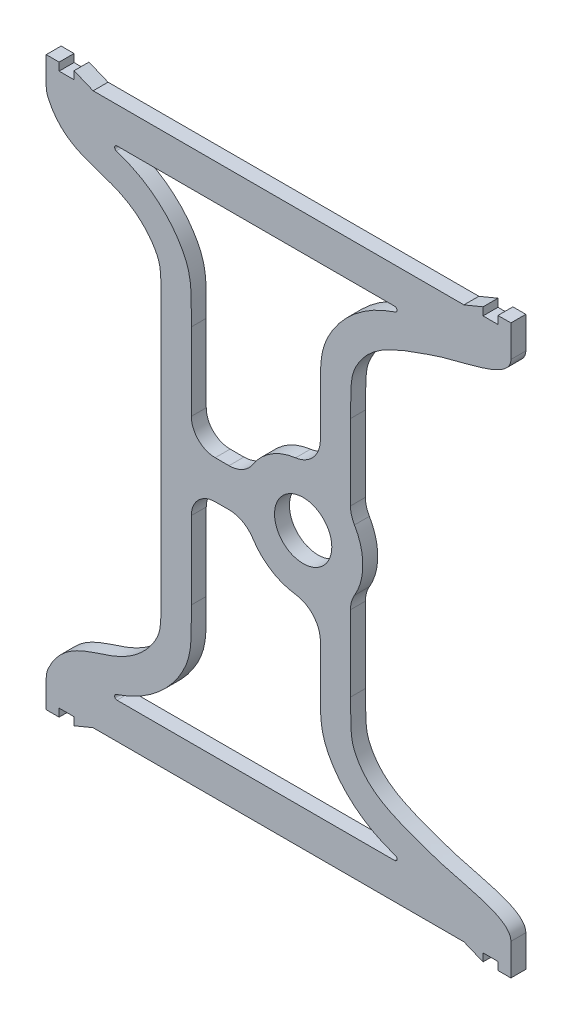
from build123d import *

# Parameters (mm, degrees)
SKETCH1_R           = 3.048
BOSS_EXTRUDE2_DEPTH = 1.5875
FILLET1_R           = 0.254
FILLET2_R           = 2.54


with BuildPart() as part:
    # Sketch1 → Boss-Extrude2 (new body)
    with BuildSketch(Plane.XY):
        with BuildLine():
            Line((-63.445118236, 56.995272298), (-61.413118236, 56.1594))
            Line((-61.413118236, 56.1594), (-21.954933142, 56.1594))
            Line((-21.954933142, 56.1594), (-19.922933142, 56.995272298))
            Line((-19.922933142, 56.995272298), (-19.922933142, 56.1594))
            Line((-19.922933142, 56.1594), (-18.335433142, 56.1594))
            Line((-18.335433142, 56.1594), (-18.335433142, 56.995272298))
            Line((-18.335433142, 56.995272298), (-16.959467842, 56.995272298))
            Line((-16.959467842, 56.995272298), (-16.959467842, 53.6194))
            add(Edge.make_bspline(
                [(-16.959467842, 53.6194), (-16.958675299, 51.706853552), (-22.34771901, 50.873251668), (-27.970226959, 48.915271091), (-28.3324007, 48.778613338), (-32.040022312, 47.058809649), (-34.043884909, 44.084161427), (-33.977658838, 42.841164425), (-34.028382429, 39.645281186)],
                knots=[0, 0, 0, 0, 0.161069097, 0.19942284, 0.363080258, 0.414817965, 0.696342734, 1, 1, 1, 1], degree=3))
            Line((-34.028382429, 39.645281186), (-34.028382429, 31.59256633))
            ThreePointArc((-34.028382429, 31.59256633), (-33.920729589, 30.793871006), (-33.6054545, 30.052180389))
            ThreePointArc((-33.6054545, 30.052180389), (-32.7152, 26.8097), (-33.6054545, 23.567219611))
            ThreePointArc((-33.6054545, 23.567219611), (-33.920729589, 22.825528994), (-34.028382429, 22.02683367))
            Line((-34.028382429, 22.02683367), (-34.028382429, 13.974118814))
            add(Edge.make_bspline(
                [(-16.959467842, 0), (-16.958675299, 1.912546448), (-22.34771901, 2.746148332), (-27.970226959, 4.704128909), (-28.3324007, 4.840786662), (-32.040022312, 6.560590351), (-34.043884909, 9.535238573), (-33.977658838, 10.778235575), (-34.028382429, 13.974118814)],
                knots=[0, 0, 0, 0, 0.161069097, 0.19942284, 0.363080258, 0.414817965, 0.696342734, 1, 1, 1, 1], degree=3))
            Line((-16.959467842, 0), (-16.959467842, -3.375872298))
            Line((-16.959467842, -3.375872298), (-18.335433142, -3.375872298))
            Line((-18.335433142, -3.375872298), (-18.335433142, -2.54))
            Line((-18.335433142, -2.54), (-19.922933142, -2.54))
            Line((-19.922933142, -2.54), (-19.922933142, -3.375872298))
            Line((-19.922933142, -3.375872298), (-21.954933142, -2.54))
            Line((-21.954933142, -2.54), (-61.413118236, -2.54))
            Line((-61.413118236, -2.54), (-63.445118236, -3.375872298))
            Line((-63.445118236, -3.375872298), (-63.445118236, -2.54))
            Line((-63.445118236, -2.54), (-65.032618236, -2.54))
            Line((-65.032618236, -2.54), (-65.032618236, -3.375872298))
            Line((-65.032618236, -3.375872298), (-66.408583535, -3.375872298))
            Line((-66.408583535, -3.375872298), (-66.408583535, 0))
            add(Edge.make_bspline(
                [(-66.408583535, 0), (-64.924134504, 3.970970778), (-61.093412842, 4.200703757), (-56.357340235, 6.517802076), (-54.056381444, 9.552241713), (-54.218088214, 10.785685691), (-54.167482869, 13.974118814)],
                knots=[0, 0, 0, 0, 0.36456502, 0.416182118, 0.697050608, 1, 1, 1, 1], degree=3))
            Line((-54.167482869, 13.974118814), (-54.167482869, 39.645281186))
            add(Edge.make_bspline(
                [(-66.408583535, 53.6194), (-64.924134504, 49.648429222), (-61.093412842, 49.418696243), (-56.357340235, 47.101597924), (-54.056381444, 44.067158287), (-54.218088214, 42.833714309), (-54.167482869, 39.645281186)],
                knots=[0, 0, 0, 0, 0.36456502, 0.416182118, 0.697050608, 1, 1, 1, 1], degree=3))
            Line((-66.408583535, 53.6194), (-66.408583535, 56.995272298))
            Line((-66.408583535, 56.995272298), (-65.032618236, 56.995272298))
            Line((-65.032618236, 56.995272298), (-65.032618236, 56.1594))
            Line((-65.032618236, 56.1594), (-63.445118236, 56.1594))
            Line((-63.445118236, 56.1594), (-63.445118236, 56.995272298))
        make_face()
        with Locations((-39.0652, 26.8097)):
            Circle(SKETCH1_R, mode=Mode.SUBTRACT)
        with BuildLine():
            Line((-60.420212319, 1.27), (-27.775652978, 1.27))
            add(Edge.make_bspline(
                [(-27.775652978, 1.27), (-27.937911803, 1.32747018), (-28.25192712, 1.434141719), (-28.977709802, 1.674229834), (-29.985010449, 2.012002863), (-31.331272347, 2.602546577), (-32.501735131, 3.28929043), (-33.532725298, 4.048582933), (-34.708077518, 5.120067508), (-35.601932415, 6.225598517), (-36.251519703, 7.294831691), (-36.629031327, 8.051039086), (-36.957652822, 8.969633494), (-37.136118728, 9.912816354), (-37.202804657, 10.779703127), (-37.222481171, 11.653006435), (-37.224921762, 12.504225188), (-37.227129046, 13.297769798), (-37.22983639, 13.76903369), (-37.231674963, 13.995349312)],
                knots=[0.254793571, 0.254793571, 0.254793571, 0.254793571, 0.278081272, 0.301368973, 0.347944374, 0.394519776, 0.441095178, 0.48767058, 0.534245982, 0.627396785, 0.673972187, 0.720547589, 0.767122991, 0.813698393, 0.860273795, 0.906849196, 0.953424598, 0.976712299, 1, 1, 1, 1], degree=3))
            Line((-37.231674963, 13.995349312), (-37.231674963, 17.518066134))
            ThreePointArc((-37.231674963, 17.518066134), (-37.984519135, 19.511899309), (-39.867288431, 20.510560841))
            ThreePointArc((-39.867288431, 20.510560841), (-42.460247999, 21.443495654), (-44.413829101, 23.387030466))
            ThreePointArc((-44.413829101, 23.387030466), (-45.506465964, 24.407291846), (-46.954770627, 24.7777))
            Line((-46.954770627, 24.7777), (-48.424190334, 24.7777))
            ThreePointArc((-48.424190334, 24.7777), (-50.220241558, 24.033751224), (-50.964190334, 22.2377))
            Line((-50.964190334, 22.2377), (-50.964190334, 13.995349312))
            add(Edge.make_bspline(
                [(-50.964190334, 13.995349312), (-50.966028907, 13.76903369), (-50.968736252, 13.297769798), (-50.970943536, 12.504225188), (-50.973384126, 11.653006435), (-50.99306064, 10.779703127), (-51.059746569, 9.912816354), (-51.238212475, 8.969633494), (-51.56683397, 8.051039086), (-51.944345594, 7.294831691), (-52.593932882, 6.225598517), (-53.487787779, 5.120067508), (-54.663139999, 4.048582933), (-55.694130166, 3.28929043), (-56.86459295, 2.602546577), (-58.210854848, 2.012002863), (-59.218155496, 1.674229834), (-59.943938178, 1.434141719), (-60.257953494, 1.32747018), (-60.420212319, 1.27)],
                knots=[0.254793571, 0.254793571, 0.254793571, 0.254793571, 0.278081272, 0.301368973, 0.347944374, 0.394519776, 0.441095178, 0.48767058, 0.534245982, 0.580821384, 0.627396785, 0.720547589, 0.767122991, 0.813698393, 0.860273795, 0.906849196, 0.953424598, 0.976712299, 1, 1, 1, 1], degree=3))
        make_face(mode=Mode.SUBTRACT)
        with BuildLine():
            Line((-60.420212319, 52.3494), (-27.775652978, 52.3494))
            add(Edge.make_bspline(
                [(-27.775652978, 52.3494), (-27.937911803, 52.29192982), (-28.25192712, 52.185258281), (-28.977709802, 51.945170166), (-29.985010449, 51.607397137), (-31.331272347, 51.016853423), (-32.501735131, 50.33010957), (-33.532725298, 49.570817067), (-34.708077518, 48.499332492), (-35.601932415, 47.393801483), (-36.251519703, 46.324568309), (-36.629031327, 45.568360914), (-36.957652822, 44.649766506), (-37.136118728, 43.706583646), (-37.202804657, 42.839696873), (-37.222481171, 41.966393565), (-37.224921762, 41.115174812), (-37.227129046, 40.321630202), (-37.22983639, 39.85036631), (-37.231674963, 39.624050688)],
                knots=[0.254793571, 0.254793571, 0.254793571, 0.254793571, 0.278081272, 0.301368973, 0.347944374, 0.394519776, 0.441095178, 0.48767058, 0.534245982, 0.627396785, 0.673972187, 0.720547589, 0.767122991, 0.813698393, 0.860273795, 0.906849196, 0.953424598, 0.976712299, 1, 1, 1, 1], degree=3))
            Line((-37.231674963, 39.624050688), (-37.231674963, 36.101333866))
            ThreePointArc((-37.231674963, 36.101333866), (-37.984519135, 34.107500691), (-39.867288431, 33.108839159))
            ThreePointArc((-39.867288431, 33.108839159), (-42.460247999, 32.175904346), (-44.413829101, 30.232369534))
            ThreePointArc((-44.413829101, 30.232369534), (-45.506465964, 29.212108154), (-46.954770627, 28.8417))
            Line((-46.954770627, 28.8417), (-48.424190334, 28.8417))
            ThreePointArc((-48.424190334, 28.8417), (-50.220241558, 29.585648776), (-50.964190334, 31.3817))
            Line((-50.964190334, 31.3817), (-50.964190334, 39.624050688))
            add(Edge.make_bspline(
                [(-50.964190334, 39.624050688), (-50.966028907, 39.85036631), (-50.968736252, 40.321630202), (-50.970943536, 41.115174812), (-50.973384126, 41.966393565), (-50.99306064, 42.839696873), (-51.059746569, 43.706583646), (-51.238212475, 44.649766506), (-51.56683397, 45.568360914), (-51.944345594, 46.324568309), (-52.593932882, 47.393801483), (-53.487787779, 48.499332492), (-54.663139999, 49.570817067), (-55.694130166, 50.33010957), (-56.86459295, 51.016853423), (-58.210854848, 51.607397137), (-59.218155496, 51.945170166), (-59.943938178, 52.185258281), (-60.257953494, 52.29192982), (-60.420212319, 52.3494)],
                knots=[0.254793571, 0.254793571, 0.254793571, 0.254793571, 0.278081272, 0.301368973, 0.347944374, 0.394519776, 0.441095178, 0.48767058, 0.534245982, 0.580821384, 0.627396785, 0.720547589, 0.767122991, 0.813698393, 0.860273795, 0.906849196, 0.953424598, 0.976712299, 1, 1, 1, 1], degree=3))
        make_face(mode=Mode.SUBTRACT)
    extrude(amount=BOSS_EXTRUDE2_DEPTH)

    # Fillet1
    fillet1_edges = [part.edges().sort_by_distance(p)[0] for p in [
        (-27.775652978, 1.27, 0.79375),
        (-60.420212319, 1.27, 0.79375),
        (-60.420212319, 52.3494, 0.79375),
        (-27.775652978, 52.3494, 0.79375),
    ]]
    fillet(fillet1_edges, radius=FILLET1_R)

    # Fillet2
    fillet2_edges = [part.edges().sort_by_distance(p)[0] for p in [
        (-66.408583535, 0, 0.79375),
        (-66.408583535, 53.6194, 0.79375),
    ]]
    fillet(fillet2_edges, radius=FILLET2_R)


solid = part.part
